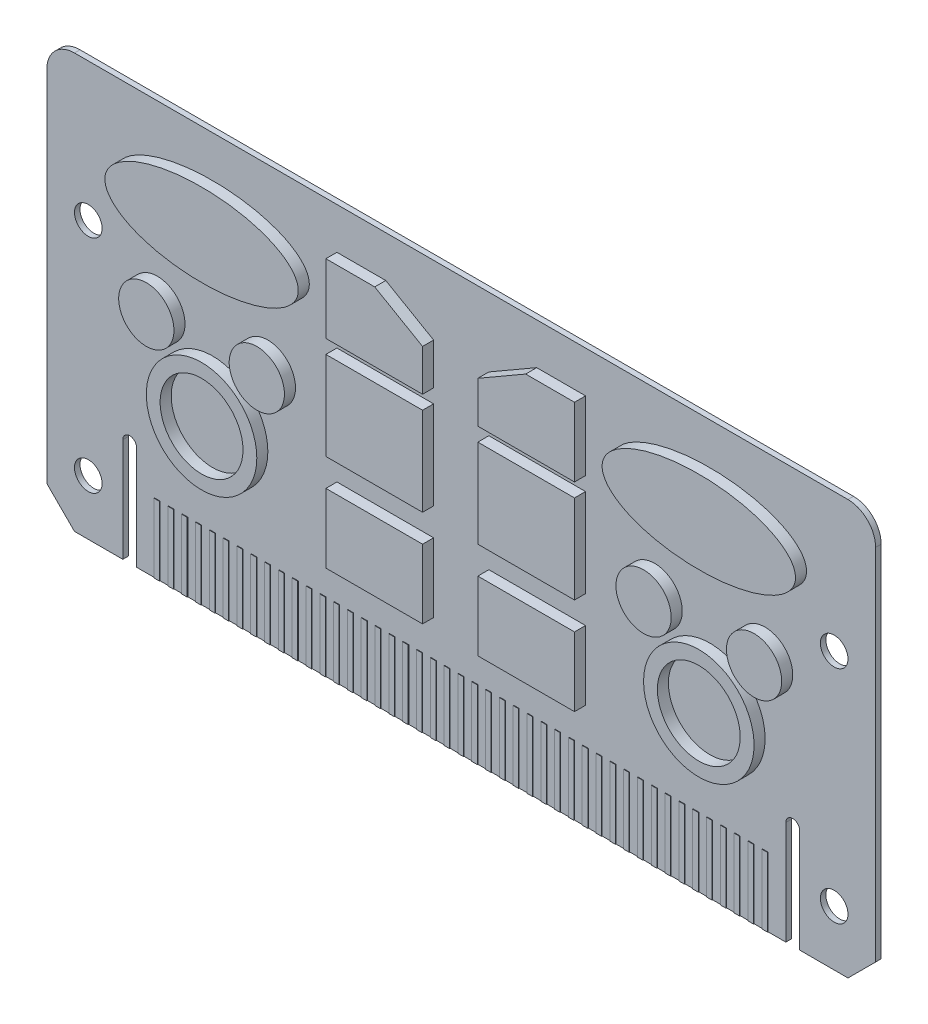
from build123d import *

# Parameters (mm, degrees)
SKETCH1_W              = 300
SKETCH1_H              = 150
PCB_BASE_DEPTH         = 1
SKETCH2_R              = 10
SKETCH2_R_2            = 20
SKETCH2_R_3            = 15
SKETCH2_RX             = 35
SKETCH2_RY             = 15
SKETCH2_W              = 35
SKETCH2_H              = 25
SKETCH2_H_2            = 32
CHIPS_DEPTH            = 4
SLOT_CUTS_DEPTH        = 10
F_10_0MM_DOWEL_HOLE1_D = 10
SKETCH6_W              = 2
SKETCH6_H              = 25
CONTACTS_DEPTH         = 0.2
LPATTERN1_COUNT        = 45
LPATTERN1_PITCH        = 5
FILLET2_R              = 10
CHAMFER2_SIZE          = 10


with BuildPart() as part:
    # Sketch1 → PCB Base (new, symmetric)
    with BuildSketch(Plane.XY):
        with Locations((-150, 75)):
            Rectangle(SKETCH1_W, SKETCH1_H)
    extrude(amount=PCB_BASE_DEPTH, both=True)

    # Sketch2 → Chips (add)
    # profile 1 of 14: a face of its own
    with BuildSketch(Plane.XY.offset(1)):
        with Locations((-260, 85)):
            Circle(SKETCH2_R)
    # profile 2 of 14: a face of its own
    with BuildSketch(Plane.XY.offset(1)):
        with Locations((-220, 85)):
            Circle(SKETCH2_R)
    # profile 3 of 14: a face of its own
    with BuildSketch(Plane.XY.offset(1)):
        with Locations((-240, 60)):
            Circle(SKETCH2_R_2)
        with Locations((-240, 60)):
            Circle(SKETCH2_R_3, mode=Mode.SUBTRACT)
    # profile 4 of 14: a face of its own
    with BuildSketch(Plane.XY.offset(1)):
        with Locations(Location((-60, 60, 0), (0, 0, 180))):
            Circle(SKETCH2_R_2)
        with Locations(Location((-60, 60, 0), (0, 0, 180))):
            Circle(SKETCH2_R_3, mode=Mode.SUBTRACT)
    # profile 5 of 14: a face of its own
    with BuildSketch(Plane.XY.offset(1)):
        with Locations(Location((-80, 85, 0), (0, 0, 180))):
            Circle(SKETCH2_R)
    # profile 6 of 14: a face of its own
    with BuildSketch(Plane.XY.offset(1)):
        with Locations(Location((-40, 85, 0), (0, 0, 180))):
            Circle(SKETCH2_R)
    # profile 7 of 14: a face of its own
    with BuildSketch(Plane.XY.offset(1)):
        with Locations(Location((-240, 120), (0, 0, 180))):
            Ellipse(SKETCH2_RX, SKETCH2_RY)
    # profile 8 of 14: a face of its own
    with BuildSketch(Plane.XY.offset(1)):
        with Locations((-60, 120)):
            Ellipse(SKETCH2_RX, SKETCH2_RY)
    # profile 9 of 14: a face of its own
    with BuildSketch(Plane.XY.offset(1)):
        with Locations((-177.5, 50.5)):
            Rectangle(SKETCH2_W, SKETCH2_H)
    # profile 10 of 14: a face of its own
    with BuildSketch(Plane.XY.offset(1)):
        with Locations((-177.5, 89)):
            Rectangle(SKETCH2_W, SKETCH2_H_2)
    # profile 11 of 14: a face of its own
    with BuildSketch(Plane.XY.offset(1)):
        Polygon((-195, 110), (-160, 110), (-160, 125), (-177.320508076, 135), (-195, 135), align=None)
    # profile 12 of 14: a face of its own
    with BuildSketch(Plane.XY.offset(1)):
        Polygon((-140, 125), (-122.679491924, 135), (-105, 135), (-105, 110), (-140, 110), align=None)
    # profile 13 of 14: a face of its own
    with BuildSketch(Plane.XY.offset(1)):
        with Locations((-122.5, 89)):
            Rectangle(SKETCH2_W, SKETCH2_H_2)
    # profile 14 of 14: a face of its own
    with BuildSketch(Plane.XY.offset(1)):
        with Locations((-122.5, 50.5)):
            Rectangle(SKETCH2_W, SKETCH2_H)
    chips = extrude(amount=CHIPS_DEPTH)

    # Mirror1: Chips across plane
    add(chips.mirror(Plane.XY))

    # Sketch3 → Slot Cuts (cut)
    with BuildSketch(Plane.XY.offset(1)):
        with BuildLine():
            Line((-272.5, 37.5), (-272.5, 0))
            Line((-272.5, 0), (-267.5, 0))
            Line((-267.5, 0), (-267.5, 37.5))
            ThreePointArc((-267.5, 37.5), (-270, 40), (-272.5, 37.5))
        make_face()
        with BuildLine():
            Line((-32.5, 0), (-32.5, 37.5))
            ThreePointArc((-32.5, 37.5), (-30, 40), (-27.5, 37.5))
            Line((-27.5, 37.5), (-27.5, 0))
            ThreePointArc((-27.5, 0), (-30, -2.5), (-32.5, 0))
        make_face()
    extrude(amount=-SLOT_CUTS_DEPTH, mode=Mode.SUBTRACT)

    # Ø10.0mm Dowel Hole1 (through all)
    with Locations(Plane.XY.offset(1)):
        with Locations((-285, 20), (-285, 100), (-15, 100), (-15, 20)):
            Hole(F_10_0MM_DOWEL_HOLE1_D / 2)

    # Sketch6 → Contacts (add)
    with BuildSketch(Plane.XY.offset(1)):
        with Locations((-260, 12.5)):
            Rectangle(SKETCH6_W, SKETCH6_H)
    contacts = extrude(amount=CONTACTS_DEPTH)

    # LPattern1: Contacts ×45
    with Locations(*[(i * LPATTERN1_PITCH, 0, 0) for i in range(1, LPATTERN1_COUNT)]):
        add(contacts)

    # Fillet2
    fillet2_edges = [part.edges().sort_by_distance(p)[0] for p in [
        (-300, 150, 0),
        (0, 150, 0),
    ]]
    fillet(fillet2_edges, radius=FILLET2_R)

    # Chamfer2
    chamfer2_edges = [part.edges().sort_by_distance(p)[0] for p in [
        (0, 0, 0),
        (-300, 0, 0),
    ]]
    chamfer(chamfer2_edges, length=CHAMFER2_SIZE)


solid = part.part
